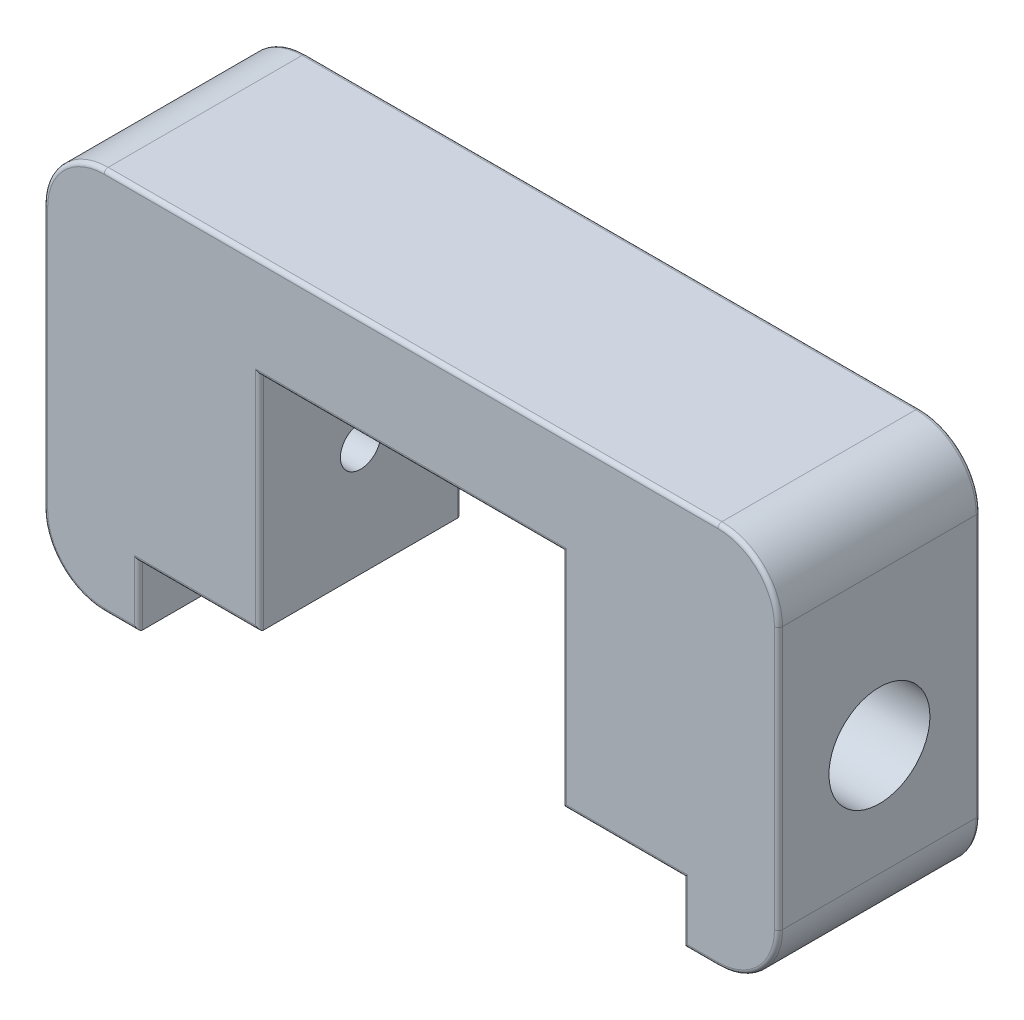
from build123d import *

# Parameters (mm, degrees)
EXTRUDE_1_DEPTH     = 10
SKETCH_2_R          = 1
CUT_EXTRUDE_1_DEPTH = 39.925698452
SKETCH_3_R          = 2.5
CUT_EXTRUDE_2_DEPTH = 5
CUT_EXTRUDE_START   = -31.4
SKETCH_3_2_R        = 2.5
CUT_EXTRUDE_3_DEPTH = 5
FILLET_1_R          = 3
FILLET_2_R          = 0.2


with BuildPart() as part:
    # 스케치1 → 보스-돌출1 (new body)
    with BuildSketch(Plane.XY):
        Polygon((18.2, 9.5), (-18.2, 9.5), (-18.2, -9.5), (-13.5, -9.5), (-13.5, -6.5), (-7.5, -6.5), (-7.5, 4.5), (7.5, 4.5), (7.5, -6.5), (13.5, -6.5), (13.5, -9.5), (18.2, -9.5), align=None)
    extrude(amount=EXTRUDE_1_DEPTH)

    # 스케치2 → 컷-돌출1 (cut, through all)
    with BuildSketch(Plane(origin=(18.2, 0, 0), x_dir=(0, 0, -1), z_dir=(1, 0, 0))):
        with Locations(Location((-5, -1, 0), (0, 0, 90))):
            Circle(SKETCH_2_R)
    extrude(amount=-CUT_EXTRUDE_1_DEPTH, mode=Mode.SUBTRACT)

    # 스케치3 → 컷-돌출2 (cut)
    with BuildSketch(Plane(origin=(18.2, 0, 0), x_dir=(0, 0, -1), z_dir=(1, 0, 0))):
        with Locations(Location((-5, -1, 0), (0, 0, 90))):
            Circle(SKETCH_3_R)
    extrude(amount=-CUT_EXTRUDE_2_DEPTH, mode=Mode.SUBTRACT)

    # 스케치3<2> → 컷-돌출3 (cut)
    with BuildSketch(Plane(origin=(18.2, 0, 0), x_dir=(0, 0, -1), z_dir=(1, 0, 0)).offset(CUT_EXTRUDE_START)):
        with Locations(Location((-5, -1, 0), (0, 0, 90))):
            Circle(SKETCH_3_2_R)
    extrude(amount=-CUT_EXTRUDE_3_DEPTH, mode=Mode.SUBTRACT)

    # 필렛1
    fillet_1_edges = [part.edges().sort_by_distance(p)[0] for p in [
        (-18.2, -9.5, 5),
        (-18.2, 9.5, 5),
        (18.2, 9.5, 5),
        (18.2, -9.5, 5),
    ]]
    fillet(fillet_1_edges, radius=FILLET_1_R)

    # 필렛2
    fillet_2_edges = [part.edges().sort_by_distance(p)[0] for p in [
        (14.35, -9.5, 10),
        (10.5, -6.5, 0),
        (7.5, -1, 0),
        (0, 4.5, 0),
        (-7.5, -1, 0),
        (-10.5, -6.5, 0),
        (-13.5, -8, 0),
        (14.35, -9.5, 0),
        (13.5, -8, 0),
        (-13.5, -8, 10),
        (-10.5, -6.5, 10),
        (-7.5, -1, 10),
        (0, 4.5, 10),
        (7.5, -1, 10),
        (-14.35, -9.5, 0),
        (-14.35, -9.5, 10),
        (10.5, -6.5, 10),
        (-18.2, 0, 0),
        (13.5, -8, 10),
        (0, 9.5, 0),
        (18.2, 0, 0),
        (17.321320344, 8.621320344, 0),
        (-17.321320344, 8.621320344, 0),
        (17.321320344, -8.621320344, 0),
        (-17.321320344, -8.621320344, 0),
        (-18.2, 0, 10),
        (18.2, 0, 10),
        (0, 9.5, 10),
        (17.321320344, 8.621320344, 10),
        (-17.321320344, 8.621320344, 10),
        (17.321320344, -8.621320344, 10),
        (-17.321320344, -8.621320344, 10),
    ]]
    fillet(fillet_2_edges, radius=FILLET_2_R)


solid = part.part
